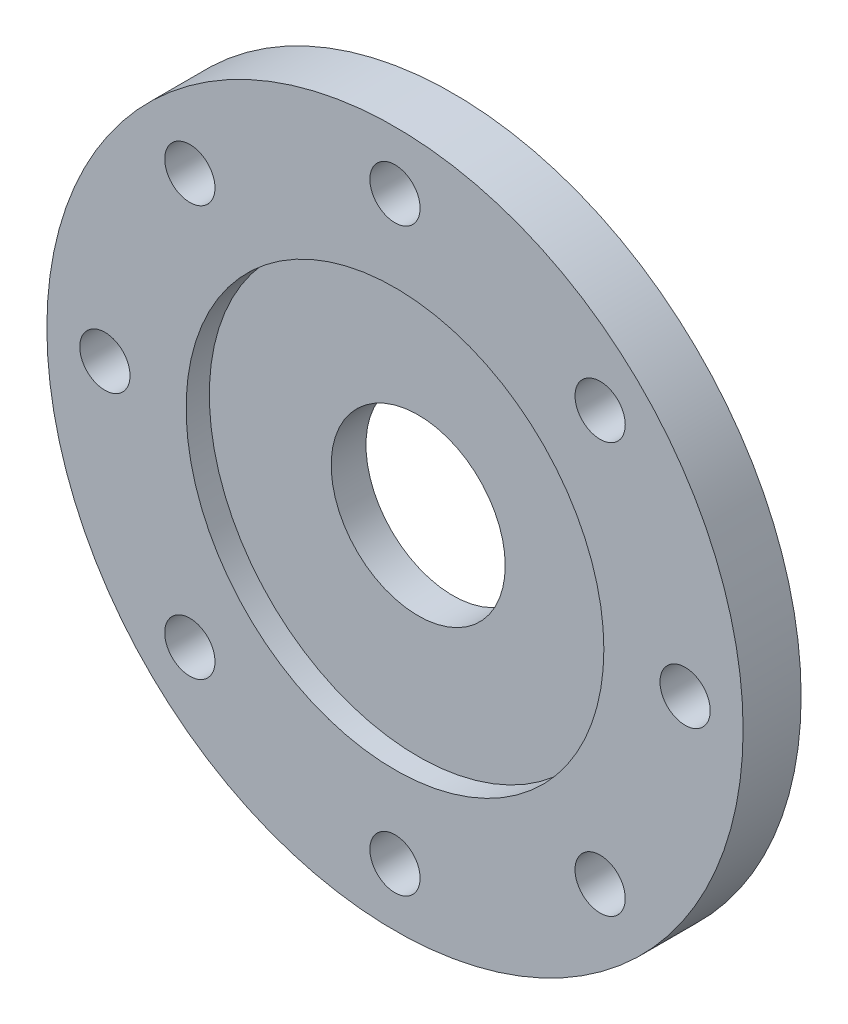
from build123d import *

# Parameters (mm, degrees)
SKETCH1_R           = 19.05
SKETCH1_R_2         = 1.375
SKETCH1_R_3         = 4.7625
BOSS_EXTRUDE1_DEPTH = 3.175
SKETCH2_R           = 11.43
CUT_EXTRUDE1_DEPTH  = 1.27


with BuildPart() as part:
    # Sketch1 → Boss-Extrude1 (new body)
    with BuildSketch(Plane.XY):
        Circle(SKETCH1_R)
        with Locations((0, 15.875)):
            Circle(SKETCH1_R_2, mode=Mode.SUBTRACT)
        with Locations((11.225320151, 11.225320151)):
            Circle(SKETCH1_R_2, mode=Mode.SUBTRACT)
        with Locations((15.875, 0)):
            Circle(SKETCH1_R_2, mode=Mode.SUBTRACT)
        Circle(SKETCH1_R_3, mode=Mode.SUBTRACT)
        with Locations((11.225320151, -11.225320151)):
            Circle(SKETCH1_R_2, mode=Mode.SUBTRACT)
        with Locations((0, -15.875)):
            Circle(SKETCH1_R_2, mode=Mode.SUBTRACT)
        with Locations((-11.225320151, -11.225320151)):
            Circle(SKETCH1_R_2, mode=Mode.SUBTRACT)
        with Locations((-15.875, 0)):
            Circle(SKETCH1_R_2, mode=Mode.SUBTRACT)
        with Locations((-11.225320151, 11.225320151)):
            Circle(SKETCH1_R_2, mode=Mode.SUBTRACT)
    extrude(amount=BOSS_EXTRUDE1_DEPTH)

    # Sketch2 → Cut-Extrude1 (cut)
    with BuildSketch(Plane.XY.offset(3.175)):
        Circle(SKETCH2_R)
    extrude(amount=-CUT_EXTRUDE1_DEPTH, mode=Mode.SUBTRACT)


solid = part.part
